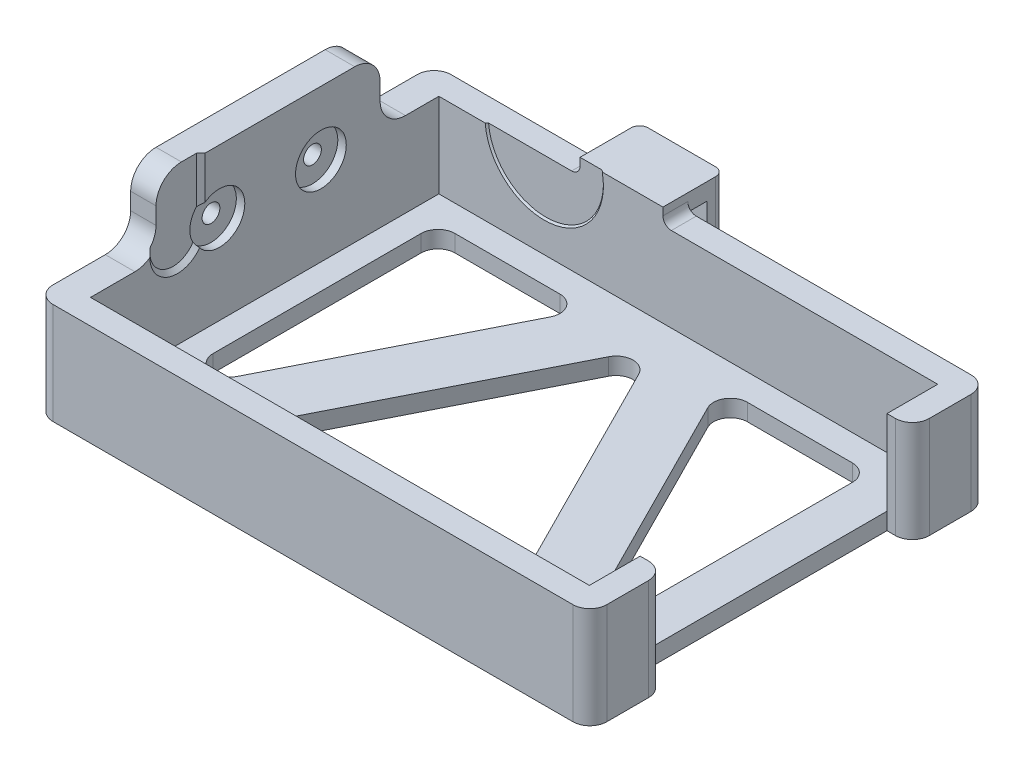
from build123d import *

# Parameters (mm, degrees)
SKETCH1_W           = 65.5
SKETCH1_H           = 47.08
BOSS_EXTRUDE1_DEPTH = 2
BOSS_EXTRUDE2_DEPTH = 10
BOSS_EXTRUDE3_DEPTH = 3.5
SKETCH4_R           = 1.05
CUT_EXTRUDE1_DEPTH  = 73.418102709
CUT_EXTRUDE3_DEPTH  = 72.891457072
CUT_EXTRUDE8_DEPTH  = 0.5
CUT_EXTRUDE8_DRAFT  = -45
SKETCH25_W          = 3
SKETCH25_H          = 29.2
CUT_EXTRUDE10_DEPTH = 72.891457072
FILLET1_R           = 2
BOSS_EXTRUDE4_DEPTH = 10
FILLET2_R           = 1
SKETCH27_R          = 3
CUT_EXTRUDE11_DEPTH = 1
FILLET4_R           = 1
SKETCH24_R          = 7
CUT_EXTRUDE9_DEPTH  = 0.2
CUT_EXTRUDE9_DRAFT  = -45


with BuildPart() as part:
    # Sketch1 → Boss-Extrude1 (new body)
    with BuildSketch(Plane(origin=(0, 0, 0), x_dir=(1, 0, 0), z_dir=(0, 1, 0))):
        with Locations((32.75, 0)):
            Rectangle(SKETCH1_W, SKETCH1_H)
    extrude(amount=BOSS_EXTRUDE1_DEPTH)

    # Sketch2 → Boss-Extrude2 (add)
    with BuildSketch(Plane(origin=(0, 2, 0), x_dir=(1, 0, 0), z_dir=(0, 1, 0))):
        Polygon((3.5, 20.6), (62.5, 20.6), (62.5, 14.6), (65.5, 14.6), (65.5, 23.54), (0, 23.54), (0, -23.54), (65.5, -23.54), (65.5, -14.6), (62.5, -14.6), (62.5, -20.6), (3.5, -20.6), align=None)
    extrude(amount=BOSS_EXTRUDE2_DEPTH)

    # Sketch3 → Boss-Extrude3 (add)
    with BuildSketch(Plane.ZY):
        with BuildLine():
            Line((-16.65, 12), (-0.65, 12))
            Line((-0.65, 12), (-0.65, 20))
            Line((-0.65, 20), (-10.65, 20))
            ThreePointArc((-10.65, 20), (-12.771320344, 19.121320344), (-13.65, 17))
            Line((-13.65, 17), (-13.65, 15))
            ThreePointArc((-13.65, 15), (-14.528679656, 12.878679656), (-16.65, 12))
        make_face()
        with BuildLine():
            Line((-0.65, 20), (-0.65, 12))
            Line((-0.65, 12), (15.35, 12))
            ThreePointArc((15.35, 12), (13.228679656, 12.878679656), (12.35, 15))
            Line((12.35, 15), (12.35, 17))
            ThreePointArc((12.35, 17), (11.471320344, 19.121320344), (9.35, 20))
            Line((9.35, 20), (-0.65, 20))
        make_face()
    extrude(amount=-BOSS_EXTRUDE3_DEPTH)

    # Sketch4 → Cut-Extrude1 (cut, through all)
    with BuildSketch(Plane.ZY):
        with Locations((-6.65, 12.5)):
            Circle(SKETCH4_R)
        with Locations((5.35, 12.5)):
            Circle(SKETCH4_R)
    extrude(amount=-CUT_EXTRUDE1_DEPTH, mode=Mode.SUBTRACT)

    # Sketch6 → Cut-Extrude3 (cut, through all)
    with BuildSketch(Plane(origin=(0, 2, 0), x_dir=(1, 0, 0), z_dir=(0, 1, 0))):
        with BuildLine():
            Line((6.5, 15.5), (6.5, -9.096254447))
            ThreePointArc((6.5, -9.096254447), (8.036954343, -11.041913389), (10.285588719, -9.997183371))
            Line((10.285588719, -9.997183371), (22.695768518, 14.599071076))
            ThreePointArc((22.695768518, 14.599071076), (22.613391155, 16.548365908), (20.910179799, 17.5))
            Line((20.910179799, 17.5), (8.5, 17.5))
            ThreePointArc((8.5, 17.5), (7.085786438, 16.914213562), (6.5, 15.5))
        make_face()
        with BuildLine():
            Line((15.804231482, -14.599071076), (30.214411281, 13.961067028))
            ThreePointArc((30.214411281, 13.961067028), (32, 15.060138105), (33.785588719, 13.961067028))
            Line((33.785588719, 13.961067028), (48.195768518, -14.599071076))
            ThreePointArc((48.195768518, -14.599071076), (48.113391155, -16.548365908), (46.410179799, -17.5))
            Line((46.410179799, -17.5), (17.589820201, -17.5))
            ThreePointArc((17.589820201, -17.5), (15.886608845, -16.548365908), (15.804231482, -14.599071076))
        make_face()
        with BuildLine():
            Line((57.5, -9.096254447), (57.5, 15.5))
            ThreePointArc((57.5, 15.5), (56.914213562, 16.914213562), (55.5, 17.5))
            Line((55.5, 17.5), (43.089820201, 17.5))
            ThreePointArc((43.089820201, 17.5), (41.386608845, 16.548365908), (41.304231482, 14.599071076))
            Line((41.304231482, 14.599071076), (53.714411281, -9.997183371))
            ThreePointArc((53.714411281, -9.997183371), (55.963045657, -11.041913389), (57.5, -9.096254447))
        make_face()
    extrude(amount=-CUT_EXTRUDE3_DEPTH, mode=Mode.SUBTRACT)


with BuildPart() as cut_extrude8_tool:
    # Sketch23 → Cut-Extrude8 (with draft: the straight prism first)
    with BuildSketch(Plane(origin=(3.5, 0, 0), x_dir=(0, 0, -1), z_dir=(1, 0, 0))):
        with BuildLine():
            ThreePointArc((-13.5745, 12.541), (-10.3245, 9.291), (-7.0745, 12.541))
            Line((-7.0745, 12.541), (-7.0745, 22.997537045))
            Line((-7.0745, 22.997537045), (-13.5745, 22.997537045))
            Line((-13.5745, 22.997537045), (-13.5745, 12.541))
        make_face()
    extrude(amount=-CUT_EXTRUDE8_DEPTH)
    # Cut-Extrude8: the draft: its side faces are tilted about the plane it starts from
    cut_extrude8_sides = [cut_extrude8_tool.faces().sort_by_distance(p)[0] for p in [
        (3.25, 17.769268522, 7.0745),
        (3.25, 22.997537045, 10.3245),
        (3.25, 17.769268522, 13.5745),
        (3.25, 9.291, 10.3245),
    ]]
    draft(cut_extrude8_sides, Plane(origin=(3.5, 0, 0), x_dir=(0, 0, -1), z_dir=(1, 0, 0)), CUT_EXTRUDE8_DRAFT)


with BuildPart() as part_1:
    add(part.part)

    # Cut-Extrude8: cut by cut_extrude8_tool
    add(cut_extrude8_tool.part, mode=Mode.SUBTRACT)

    # Sketch25 → Cut-Extrude10 (cut, through all)
    with BuildSketch(Plane(origin=(0, 2, 0), x_dir=(1, 0, 0), z_dir=(0, 1, 0))):
        with Locations((64, 0)):
            Rectangle(SKETCH25_W, SKETCH25_H)
    extrude(amount=-CUT_EXTRUDE10_DEPTH, mode=Mode.SUBTRACT)

    # Fillet1
    fillet1_edges = [part_1.edges().sort_by_distance(p)[0] for p in [
        (65.5, 6, 14.6),
        (65.5, 6, -14.6),
        (65.5, 6, -23.54),
        (65.5, 6, 23.54),
        (0, 6, 23.54),
        (0, 6, -23.54),
    ]]
    fillet(fillet1_edges, radius=FILLET1_R)

    # Sketch26 → Boss-Extrude4 (add)
    with BuildSketch(Plane.ZY.offset(-20)):
        Polygon((-27.84, 0), (-23.54, 0), (-23.54, 2), (-25.84, 2), (-25.84, 11.9), (-23.54, 11.9), (-23.54, 12), (-20.6, 12), (-20.6, 13.9), (-27.84, 13.9), (-27.84, 12), align=None)
    extrude(amount=-BOSS_EXTRUDE4_DEPTH)

    # Fillet2
    fillet2_edges = [part_1.edges().sort_by_distance(p)[0] for p in [
        (20, 6.95, -27.84),
        (30, 1, -23.54),
        (30, 6.95, -27.84),
        (20, 1, -23.54),
    ]]
    fillet(fillet2_edges, radius=FILLET2_R)

    # Sketch27 → Cut-Extrude11 (cut)
    with BuildSketch(Plane(origin=(3.5, 0, 0), x_dir=(0, 0, -1), z_dir=(1, 0, 0))):
        with Locations((-5.35, 12.5)):
            Circle(SKETCH27_R)
        with Locations((6.65, 12.5)):
            Circle(SKETCH27_R)
    extrude(amount=-CUT_EXTRUDE11_DEPTH, mode=Mode.SUBTRACT)

    # Fillet4
    fillet4_edges = [part_1.edges().sort_by_distance(p)[0] for p in [
        (20, 12, -22.07),
        (30, 12, -22.07),
    ]]
    fillet(fillet4_edges, radius=FILLET4_R)


with BuildPart() as cut_extrude9_tool:
    # Sketch24 → Cut-Extrude9 (with draft: the straight prism first)
    with BuildSketch(Plane.XY.offset(-20.6)):
        with Locations((15.9587, 12.541)):
            Circle(SKETCH24_R)
    extrude(amount=-CUT_EXTRUDE9_DEPTH)
    # Cut-Extrude9: the draft: its side faces are tilted about the plane it starts from
    cut_extrude9_sides = [cut_extrude9_tool.faces().sort_by_distance(p)[0] for p in [
        (8.9587, 12.541, -20.7),
    ]]
    draft(cut_extrude9_sides, Plane.XY.offset(-20.6), CUT_EXTRUDE9_DRAFT)


with BuildPart() as part_2:
    add(part_1.part)

    # Cut-Extrude9: cut by cut_extrude9_tool
    add(cut_extrude9_tool.part, mode=Mode.SUBTRACT)


solid = part_2.part
